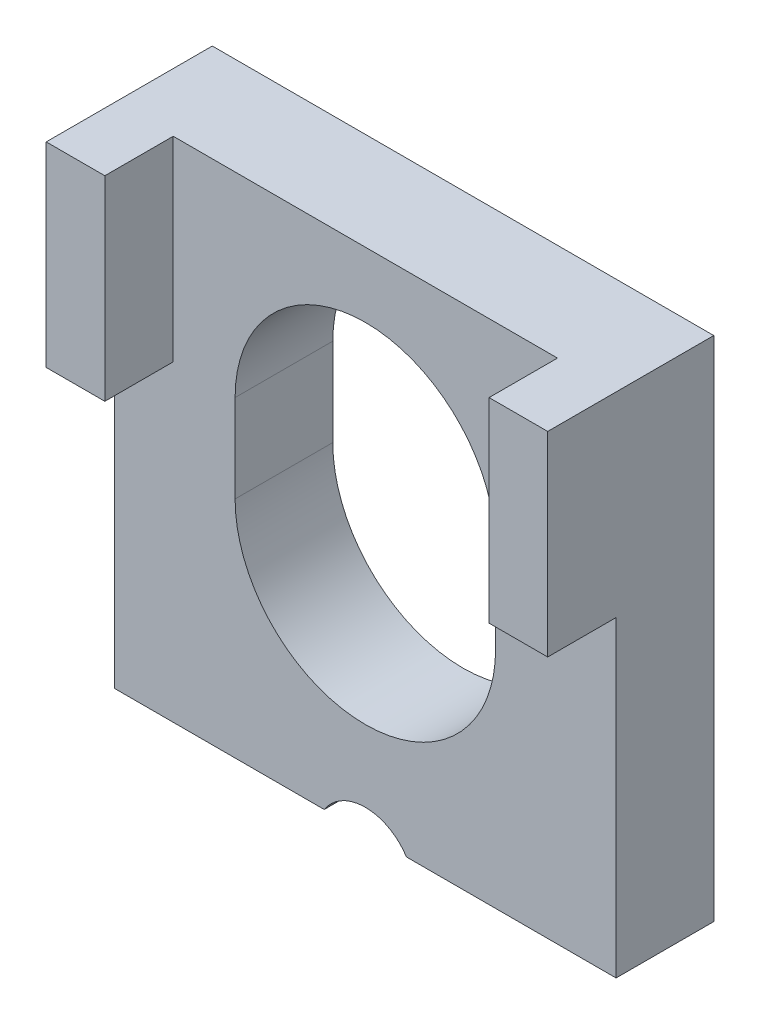
from build123d import *

# Parameters (mm, degrees)
EXTRUDE_1_DEPTH = 3
SKETCH_2_W      = 1.8
SKETCH_2_H      = 6
EXTRUDE_2_DEPTH = 2.1


with BuildPart() as part:
    # Эскиз1 → Бобышка-Вытянуть1 (new body)
    with BuildSketch(Plane.XY):
        with BuildLine():
            Line((-7.7, 13.737499607), (7.7, 13.737499607))
            Line((7.7, 13.737499607), (7.7, -0.039604792))
            Line((7.7, -0.039604792), (7.7, -1.849229377))
            Line((7.7, -1.849229377), (1.262659878, -1.849229377))
            ThreePointArc((1.262659878, -1.849229377), (0, -1.158976271), (-1.262659878, -1.849229377))
            Line((-1.262659878, -1.849229377), (-7.7, -1.849229377))
            Line((-7.7, -1.849229377), (-7.7, -0.039604792))
            Line((-7.7, -0.039604792), (-7.7, 13.737499607))
        make_face()
        with BuildLine():
            Line((4, 7.737499607), (4, 5.041023729))
            ThreePointArc((4, 5.041023729), (0, 1.041023729), (-4, 5.041023729))
            Line((-4, 5.041023729), (-4, 7.737499607))
            ThreePointArc((-4, 7.737499607), (0, 11.737499607), (4, 7.737499607))
        make_face(mode=Mode.SUBTRACT)
    extrude(amount=EXTRUDE_1_DEPTH)

    # Эскиз2 → Бобышка-Вытянуть2 (add)
    with BuildSketch(Plane.XY.offset(3)):
        with Locations((-6.8, 10.737499607)):
            Rectangle(SKETCH_2_W, SKETCH_2_H)
        with Locations((6.8, 10.737499607)):
            Rectangle(SKETCH_2_W, SKETCH_2_H)
    extrude(amount=EXTRUDE_2_DEPTH)


solid = part.part
